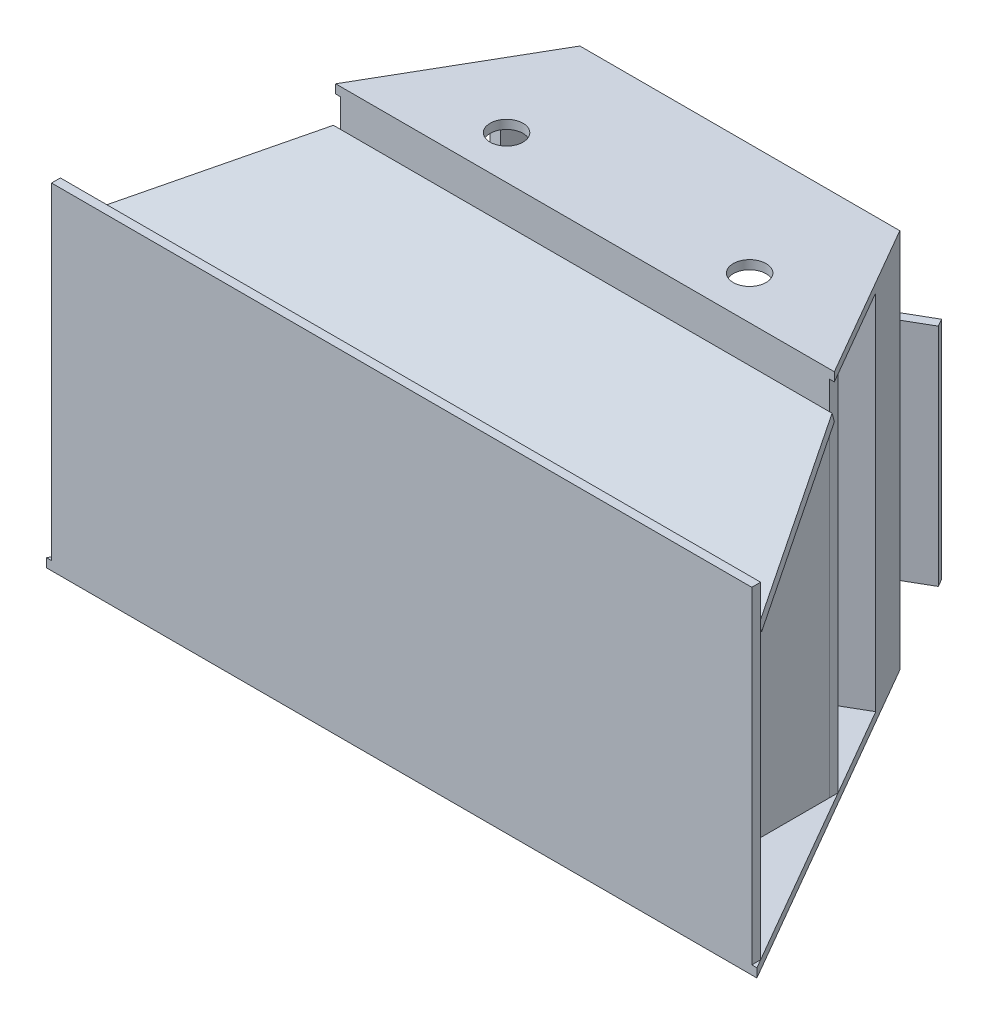
from build123d import *

# Parameters (mm, degrees)
BOSS_EXTRUDE1_DEPTH                     = 11.90625
SKETCH3_W                               = 946.658829024
SKETCH3_H                               = 11.90625
BOSS_EXTRUDE2_DEPTH                     = 442.11875
SKETCH4_W                               = 660.481708072
SKETCH4_H                               = 11.90625
BOSS_EXTRUDE3_DEPTH                     = 502.444211
BOSS_EXTRUDE4_DEPTH                     = 11.90625
CUT_EXTRUDE2_REACH                      = 1091.467
SKETCH6_R                               = 22.225
BOSS_EXTRUDE5_DEPTH                     = 11.90625
BOSS_EXTRUDE8_DEPTH                     = 11.90625
SKETCH9_W                               = 457.2
SKETCH9_H                               = 88.9
BOSS_EXTRUDE9_DEPTH                     = 2.921
BOSS_EXTRUDE10_START                    = 88.9
SKETCH10_W                              = 457.2
SKETCH10_H                              = 88.9
SKETCH10_R                              = 22.225
BOSS_EXTRUDE10_DEPTH                    = 88.9
F_5_16_0_3125_DIAMETER_HOLE1_AT_2_COUNT = 2
F_5_16_0_3125_DIAMETER_HOLE1_AT_2_PITCH = 328.618993764
BOSS_EXTRUDE11_DEPTH                    = 490.53796101
SKETCH12_W                              = 76.2
SKETCH12_H                              = 304.8
BOSS_EXTRUDE12_DEPTH                    = 11.90625
SKETCH18_W                              = 38.1
SKETCH18_H                              = 88.9
BOSS_EXTRUDE15_DEPTH                    = 636.669208072
BOSS_EXTRUDE15_2_DEPTH                  = 636.669208072
BOSS_EXTRUDE15_3_DEPTH                  = 636.669208072


with BuildPart() as part:
    # Sketch2 → Boss-Extrude1 (new body)
    with BuildSketch(Plane(origin=(0, 0, 0), x_dir=(1, 0, 0), z_dir=(0, 1, 0))):
        Polygon((-480.203491154, -831.736844651), (-216.238948081, -374.536844651), (216.238948081, -374.536844651), (480.203491154, -831.736844651), align=None)
    extrude(amount=BOSS_EXTRUDE1_DEPTH)

    # Sketch3 → Boss-Extrude2 (add)
    with BuildSketch(Plane(origin=(0, 11.90625, 0), x_dir=(1, 0, 0), z_dir=(0, 1, 0))):
        with Locations((0, -825.783719651)):
            Rectangle(SKETCH3_W, SKETCH3_H)
    extrude(amount=BOSS_EXTRUDE2_DEPTH)

    # Sketch4 → Boss-Extrude3 (add)
    with BuildSketch(Plane(origin=(0, 11.90625, 0), x_dir=(1, 0, 0), z_dir=(0, 1, 0))):
        with Locations((0, -577.947062925)):
            Rectangle(SKETCH4_W, SKETCH4_H)
    extrude(amount=BOSS_EXTRUDE3_DEPTH)

    # Sketch5 → Boss-Extrude4 (add)
    with BuildSketch(Plane(origin=(0, 514.35046101, 0), x_dir=(1, 0, 0), z_dir=(0, 1, 0))):
        Polygon((-337.114930678, -583.900187925), (-216.238948081, -374.536844651), (216.238948081, -374.536844651), (337.114930678, -583.900187925), align=None)
    extrude(amount=-BOSS_EXTRUDE4_DEPTH)

    # Sketch6 → Cut-Extrude2 (cut, up to next)
    with BuildSketch(Plane(origin=(0, 514.35046101, 0), x_dir=(1, 0, 0), z_dir=(0, 1, 0)), mode=Mode.PRIVATE) as cut_extrude2_sk1:
        with Locations(Location((-164.309496882, -525.607187925, 0), (0, 0, 270))):
            Circle(SKETCH6_R)
    cut_extrude2_tool1 = extrude(cut_extrude2_sk1.sketch, amount=-CUT_EXTRUDE2_REACH, mode=Mode.PRIVATE) & part.part
    # Sketch6 → Cut-Extrude2 (cut, up to next)
    with BuildSketch(Plane(origin=(0, 514.35046101, 0), x_dir=(1, 0, 0), z_dir=(0, 1, 0)), mode=Mode.PRIVATE) as cut_extrude2_sk2:
        with Locations(Location((164.309496882, -525.607187925, 0), (0, 0, 270))):
            Circle(SKETCH6_R)
    cut_extrude2_tool2 = extrude(cut_extrude2_sk2.sketch, amount=-CUT_EXTRUDE2_REACH, mode=Mode.PRIVATE) & part.part
    add(cut_extrude2_tool1.solids().sort_by_distance((-164.309497, 514.350461, 525.607188))[0], mode=Mode.SUBTRACT)
    add(cut_extrude2_tool2.solids().sort_by_distance((164.309497, 514.350461, 525.607188))[0], mode=Mode.SUBTRACT)

    # Sketch9 → Boss-Extrude9 (add)
    with BuildSketch(Plane(origin=(0, 11.90625, 0), x_dir=(1, 0, 0), z_dir=(0, 1, 0))):
        with Locations((0, -527.543937925)):
            Rectangle(SKETCH9_W, SKETCH9_H)
    extrude(amount=BOSS_EXTRUDE9_DEPTH)

    # Sketch10 → Boss-Extrude10 (add)
    with BuildSketch(Plane(origin=(0, 14.82725, 0), x_dir=(1, 0, 0), z_dir=(0, 1, 0)).offset(BOSS_EXTRUDE10_START)):
        with Locations((0, -527.543937925)):
            Rectangle(SKETCH10_W, SKETCH10_H)
        with Locations(Location((-164.309496882, -525.607187925, 0), (0, 0, 270))):
            Circle(SKETCH10_R, mode=Mode.SUBTRACT)
        with Locations(Location((164.309496882, -525.607187925, 0), (0, 0, 270))):
            Circle(SKETCH10_R, mode=Mode.SUBTRACT)
    extrude(amount=-BOSS_EXTRUDE10_DEPTH)

    # Sketch15 → 5/16 (0.3125) Diameter Hole1 (revolve, cut)
    with BuildSketch(Plane(origin=(164.309496882, 78.32725, 483.093937925), x_dir=(0, 1, 0), z_dir=(1, 0, 0))):
        Polygon((0, 0), (0, 103.190915582), (3.96875, 100.80625), (3.96875, 0), align=None)
    f_5_16_0_3125_diameter_hole1 = revolve(axis=Axis((164.309496882, 78.32725, 476.743937925), (0, 0, 1)), mode=Mode.SUBTRACT)

    # 5/16 (0.3125) Diameter Hole1 at 2: 5/16 (0.3125) Diameter Hole1 ×2
    with Locations(*[(-i * F_5_16_0_3125_DIAMETER_HOLE1_AT_2_PITCH, 0, 0) for i in range(1, F_5_16_0_3125_DIAMETER_HOLE1_AT_2_COUNT)]):
        add(f_5_16_0_3125_diameter_hole1, mode=Mode.SUBTRACT)

    # Sketch11 → Boss-Extrude11 (add)
    with BuildSketch(Plane(origin=(0, 11.90625, 0), x_dir=(1, 0, 0), z_dir=(0, 1, 0))):
        Polygon((216.238948081, -374.536844651), (260.688948081, -451.526503047), (227.693380197, -470.576503047), (183.243380197, -393.586844651), align=None)
        Polygon((-216.238948081, -374.536844651), (-260.688948081, -451.526503047), (-227.693380196, -470.576503047), (-183.243380196, -393.586844651), align=None)
    extrude(amount=BOSS_EXTRUDE11_DEPTH)

    # Sketch12 → Boss-Extrude12 (add)
    with BuildSketch(Plane(origin=(216.238948081, 0, 374.536844651), x_dir=(-0.8660254037844384, 0, 0.5000000000000004), z_dir=(-0.5000000000000004, 0, -0.8660254037844384))):
        with Locations((0, 257.175230505)):
            Rectangle(SKETCH12_W, SKETCH12_H)
    extrude(amount=BOSS_EXTRUDE12_DEPTH)


with BuildPart() as body_2:
    # Sketch7 → Boss-Extrude5 (new body)
    with BuildSketch(Plane(origin=(0, 571.258129571, 153.068154488), x_dir=(1, 0, 0), z_dir=(0, 0.965925826289068, 0.2588190451025219))):
        Polygon((-471.550272559, -687.09300222), (-337.114930678, -446.030141975), (337.114930678, -446.030141975), (471.550272559, -687.09300222), align=None)
    extrude(amount=BOSS_EXTRUDE5_DEPTH)


with BuildPart() as body_3:
    # Sketch8 → Boss-Extrude8 (new body)
    with BuildSketch(Plane(origin=(330.240854036, 0, 0), x_dir=(0, 0, -1), z_dir=(1, 0, 0))):
        Polygon((-819.830594651, 11.90625), (-819.830594651, 392.599672186), (-583.900187925, 455.817034138), (-583.900187925, 11.90625), align=None)
    extrude(amount=-BOSS_EXTRUDE8_DEPTH)


with BuildPart() as body_4:
    # Mirror2: mirrored copy
    add(body_3.part.mirror(Plane(origin=(0, 0, 0), x_dir=(0, 0, 1), z_dir=(1, 0, 0))))


with BuildPart() as body_5:
    # Sketch18 → Boss-Extrude15 (new body)
    with BuildSketch(Plane(origin=(318.334604036, 0, 0), x_dir=(0, 0, -1), z_dir=(1, 0, 0))):
        with Locations((-602.950187925, 401.158169907)):
            Rectangle(SKETCH18_W, SKETCH18_H)
    extrude(amount=-BOSS_EXTRUDE15_DEPTH)


with BuildPart() as body_6:
    # Sketch18 → Boss-Extrude15 2 (new body)
    with BuildSketch(Plane(origin=(318.334604036, 0, 0), x_dir=(0, 0, -1), z_dir=(1, 0, 0))):
        with Locations((-800.780594651, 348.97537484)):
            Rectangle(SKETCH18_W, SKETCH18_H)
    extrude(amount=-BOSS_EXTRUDE15_2_DEPTH)


with BuildPart() as body_7:
    # Sketch18 → Boss-Extrude15 3 (new body)
    with BuildSketch(Plane(origin=(318.334604036, 0, 0), x_dir=(0, 0, -1), z_dir=(1, 0, 0))):
        with Locations((-800.780594651, 56.35625)):
            Rectangle(SKETCH18_W, SKETCH18_H)
    extrude(amount=-BOSS_EXTRUDE15_3_DEPTH)


solid = Compound([part.part, body_2.part, body_3.part, body_4.part, body_5.part, body_6.part, body_7.part])
